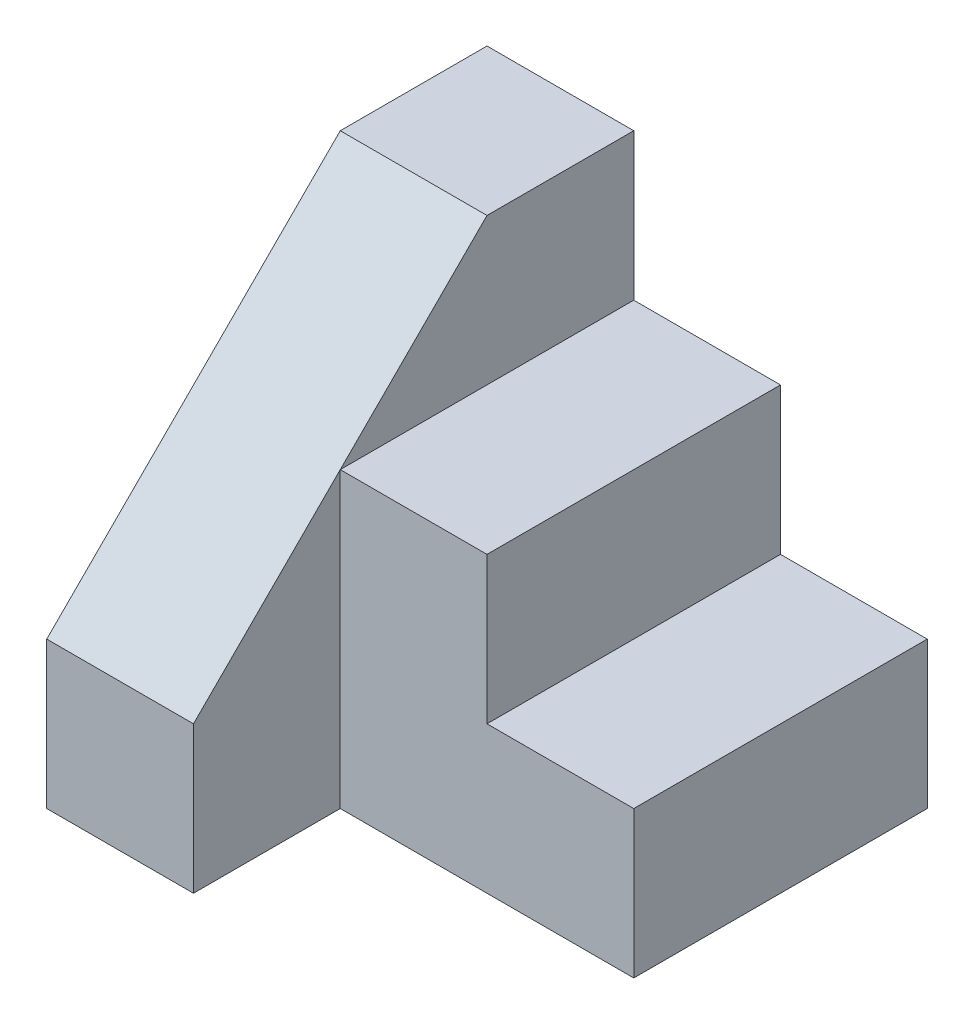
from build123d import *

# Parameters (mm, degrees)
SKETCH_1_W               = 30
SKETCH_1_H               = 30
EXTRUDE_1_DEPTH          = 30
CUT_EXTRUDE_8_DEPTH      = 52.961524227
CUT_EXTRUDE_9_DEPTH      = 47.904157598
CUT_EXTRUDE_9_DEPTH_BACK = 47.904157598
SKETCH_16_W              = 20
SKETCH_16_H              = 10
CUT_EXTRUDE_10_DEPTH     = 52.961524227


with BuildPart() as part:
    # 草圖1 → 填料-伸1 (new body)
    with BuildSketch(Plane.XY):
        with Locations((15, 15)):
            Rectangle(SKETCH_1_W, SKETCH_1_H)
    extrude(amount=-EXTRUDE_1_DEPTH)

    # 草圖11 → 除料-伸長8 (cut, through all)
    with BuildSketch(Plane.XY):
        Polygon((10, 30), (10, 20), (20, 20), (20, 10), (30, 10), (30, 30), align=None)
    extrude(amount=-CUT_EXTRUDE_8_DEPTH, mode=Mode.SUBTRACT)

    # 草圖16 → 除料-伸長9 (cut, two sides: drawn at the far end of the back side and taken through both)
    with BuildSketch(Plane(origin=(0, 10, 0), x_dir=(1, 0, 0), z_dir=(0, 1, 0)).offset(-CUT_EXTRUDE_9_DEPTH_BACK)):
        with Locations((20, 5)):
            Rectangle(SKETCH_16_W, SKETCH_16_H)
    extrude(amount=CUT_EXTRUDE_9_DEPTH + CUT_EXTRUDE_9_DEPTH_BACK, mode=Mode.SUBTRACT)

    # 草圖20 → 除料-伸長10 (cut, through all)
    with BuildSketch(Plane(origin=(30, 0, 0), x_dir=(0, 0, -1), z_dir=(1, 0, 0))):
        Polygon((0, 30), (0, 10), (20, 30), align=None)
    extrude(amount=-CUT_EXTRUDE_10_DEPTH, mode=Mode.SUBTRACT)


solid = part.part
